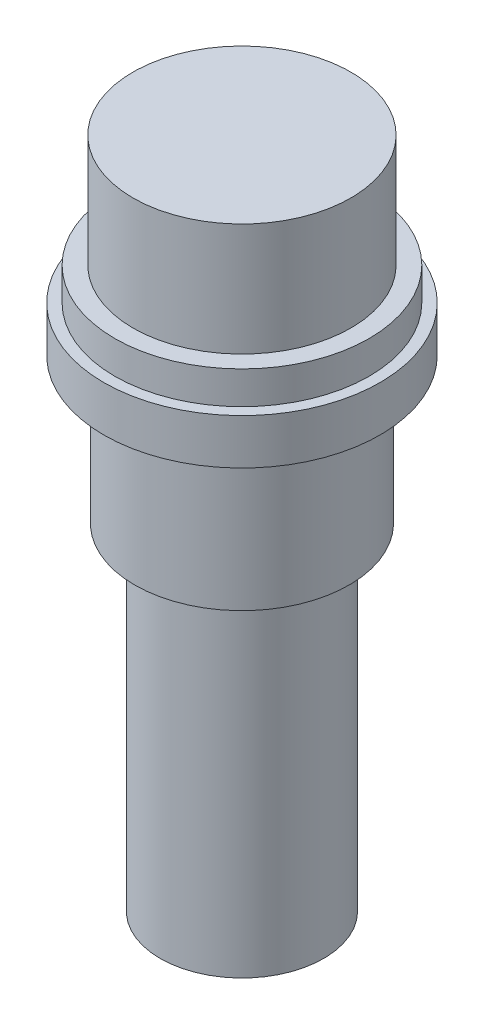
from build123d import *


with BuildPart() as part:
    # 草图1 → 旋转1 (revolve)
    with BuildSketch(Plane.XY, mode=Mode.PRIVATE) as revolve_1_sk:
        Polygon((0, 30.938694357), (6, 30.938694357), (6, 24.738694357), (7, 24.738694357), (7, 22.938694357), (7.6, 22.938694357), (7.6, 20.438694357), (5.9, 20.438694357), (5.9, 12.438694357), (4.5, 12.438694357), (4.5, -6.061305643), (0, -6.061305643), align=None)
    revolve(revolve_1_sk.sketch.rotate(Axis((0, 77.721825963, 0), (0, -1, 0)), 90), axis=Axis((0, 77.721825963, 0), (0, -1, 0)))


solid = part.part
